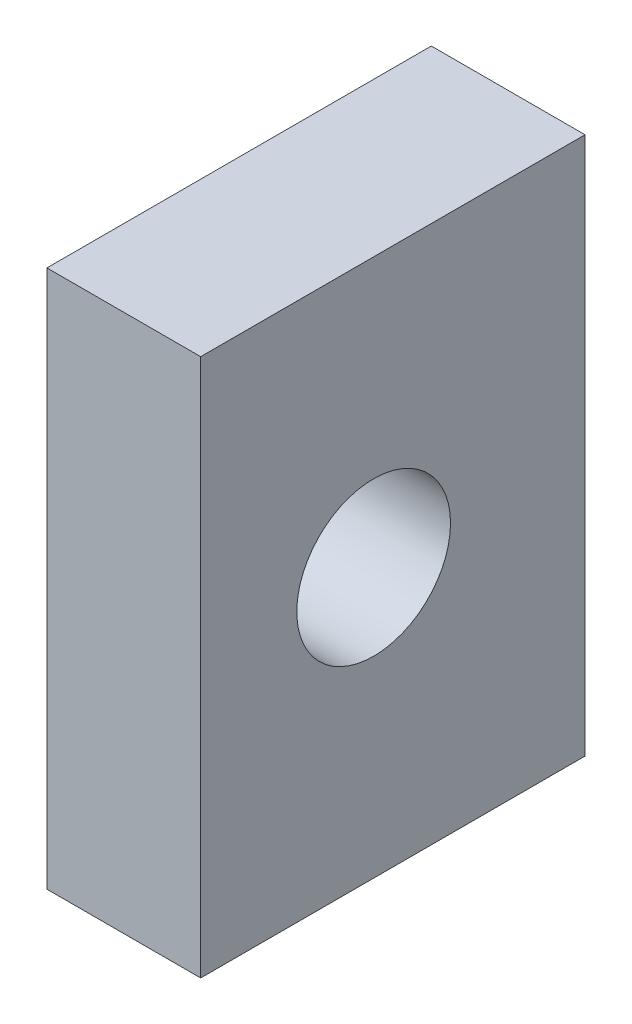
from build123d import *

# Parameters (mm, degrees)
SKETCH1_W           = 31.75
SKETCH1_H           = 44.45
SKETCH1_R           = 6.35
BOSS_EXTRUDE1_DEPTH = 12.7


with BuildPart() as part:
    # Sketch1 → Boss-Extrude1 (new body)
    with BuildSketch(Plane(origin=(0, 0, 0), x_dir=(0, 0, -1), z_dir=(1, 0, 0))):
        Rectangle(SKETCH1_W, SKETCH1_H)
        with Locations((-1.5875, 0)):
            Circle(SKETCH1_R, mode=Mode.SUBTRACT)
    extrude(amount=BOSS_EXTRUDE1_DEPTH)


solid = part.part
